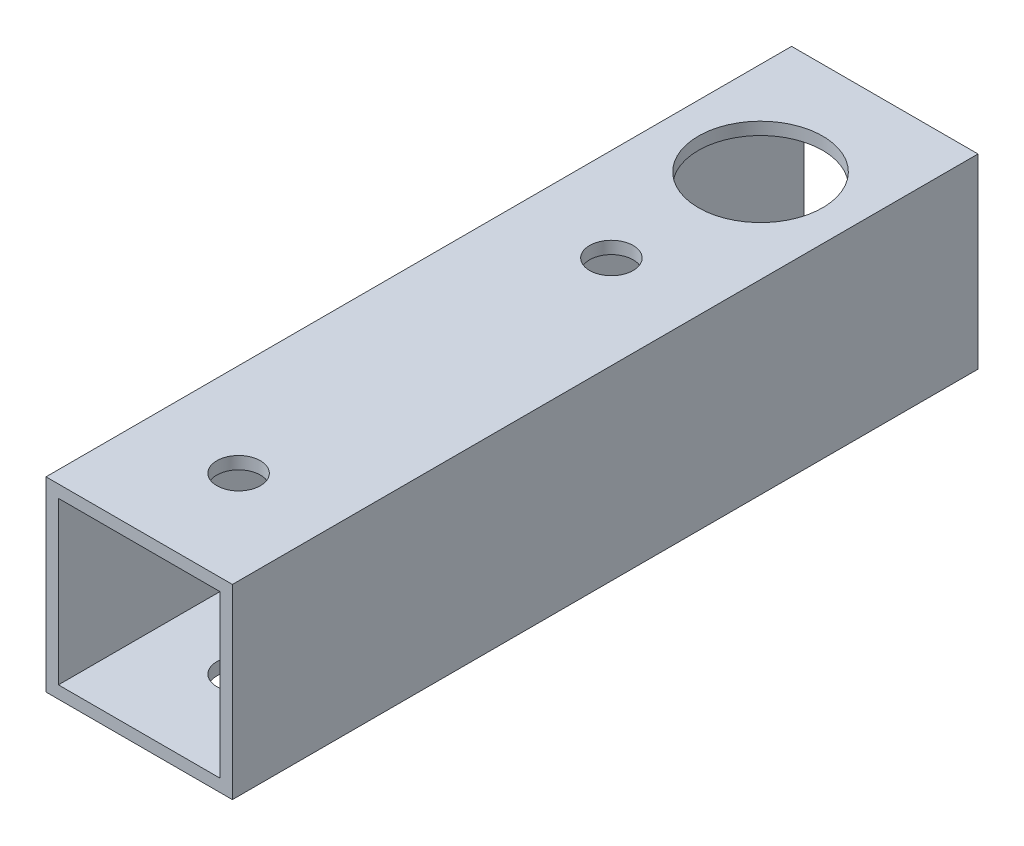
from build123d import *

# Parameters (mm, degrees)
SKIZZE1_W                       = 15
SKIZZE1_H                       = 15
SKIZZE1_W_2                     = 13
SKIZZE1_H_2                     = 13
LINEAR_AUSTRAGEN_D_NN1_DEPTH    = 30
SKIZZE2_R                       = 1.75
SKIZZE2_R_2                     = 5
SCHNITT_LINEAR_AUSTRAGEN1_DEPTH = 17


with BuildPart() as part:
    # Skizze1 → Linear-Austragen-Dünn1 (new, symmetric)
    with BuildSketch(Plane.XY):
        Rectangle(SKIZZE1_W, SKIZZE1_H)
        Rectangle(SKIZZE1_W_2, SKIZZE1_H_2, mode=Mode.SUBTRACT)
    extrude(amount=LINEAR_AUSTRAGEN_D_NN1_DEPTH, both=True)

    # Skizze2 → Schnitt-Linear austragen1 (cut)
    with BuildSketch(Plane(origin=(0, 7.5, 0), x_dir=(1, 0, 0), z_dir=(0, 1, 0))):
        with Locations(Location((0, -22, 0), (0, 0, 270))):
            Circle(SKIZZE2_R)
        with Locations(Location((0, 8, 0), (0, 0, 270))):
            Circle(SKIZZE2_R)
        with Locations(Location((0, 20, 0), (0, 0, 270))):
            Circle(SKIZZE2_R_2)
    extrude(amount=-SCHNITT_LINEAR_AUSTRAGEN1_DEPTH, mode=Mode.SUBTRACT)


solid = part.part
